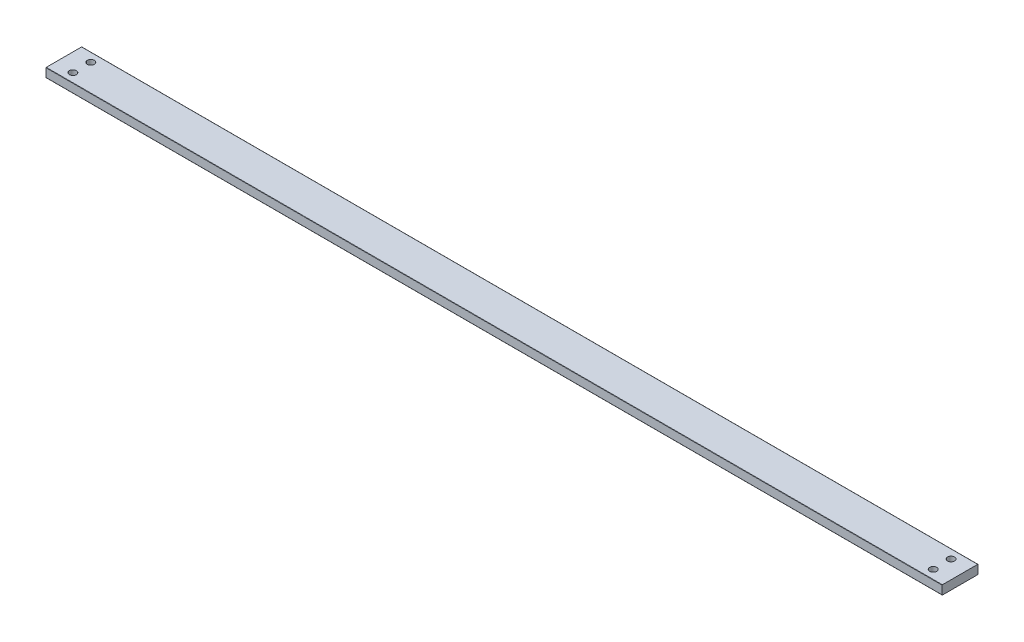
from build123d import *

# Parameters (mm, degrees)
BOSS_EXTRUDE1_DEPTH      = 3.175
BOSS_EXTRUDE1_DEPTH_BACK = 3.175
SKETCH3_W                = 635
SKETCH3_H                = 25.4
FILLET1_R                = 0.20955
F_10_CLEARANCE_HOLE1_D   = 4.9784


with BuildPart() as part:
    # Sketch3 → Boss-Extrude1 (new, two sides: drawn at the far end of the back side and taken through both)
    with BuildSketch(Plane(origin=(0, 0, 0), x_dir=(1, 0, 0), z_dir=(0, 1, 0)).offset(-BOSS_EXTRUDE1_DEPTH_BACK)):
        Rectangle(SKETCH3_W, SKETCH3_H)
    extrude(amount=BOSS_EXTRUDE1_DEPTH + BOSS_EXTRUDE1_DEPTH_BACK)

    # Fillet1
    fillet1_edges = [part.edges().sort_by_distance(p)[0] for p in [
        (0, 3.175, 12.7),
        (0, -3.175, -12.7),
        (0, 3.175, -12.7),
        (0, -3.175, 12.7),
    ]]
    fillet(fillet1_edges, radius=FILLET1_R)

    # #10 Clearance Hole1 (through all)
    with Locations(Plane(origin=(0, 3.175, 0), x_dir=(1, 0, 0), z_dir=(0, 1, 0))):
        with Locations((304.8, -6.35), (-304.8, -6.35), (304.8, 6.35), (-304.8, 6.35)):
            Hole(F_10_CLEARANCE_HOLE1_D / 2)


solid = part.part
